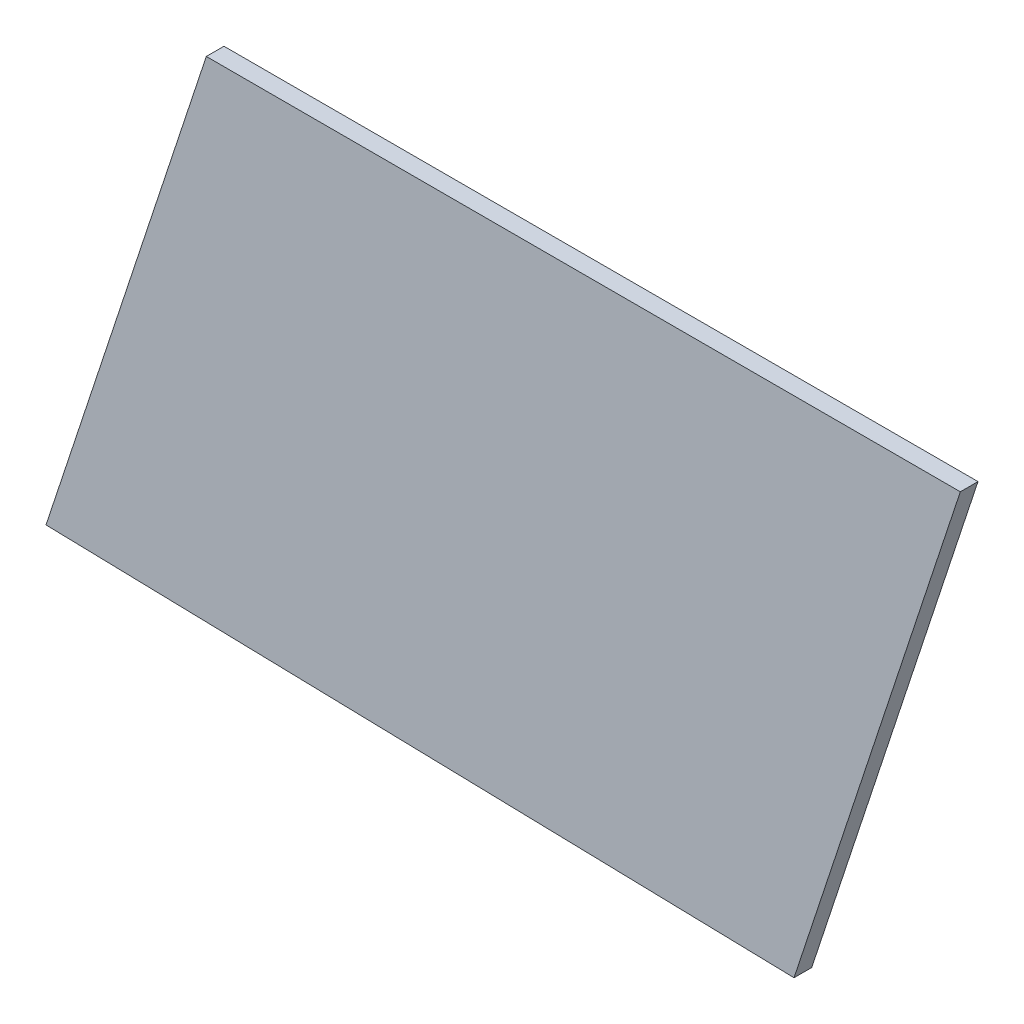
from build123d import *

# Parameters (mm, degrees)
BOSS_EXTRUDE1_DEPTH = 2
BOSS_EXTRUDE2_DEPTH = 2


with BuildPart() as part:
    # Sketch2 → Boss-Extrude1 (new body)
    with BuildSketch(Plane.XY):
        Polygon((-54.61917065, -24.589230235), (30.72482935, -24.589230235), (13.852659447, -75.725684813), (-71.491340553, -75.725684813), align=None)
    extrude(amount=BOSS_EXTRUDE1_DEPTH)

    # Sketch3 → Boss-Extrude2 (add)
    with BuildSketch(Plane.XY.offset(2)):
        Polygon((-72.764711867, -79.585039875), (11.90144755, -81.639450446), (13.852659447, -75.725684813), (-71.491340553, -75.725684813), align=None)
    extrude(amount=-BOSS_EXTRUDE2_DEPTH)


solid = part.part
